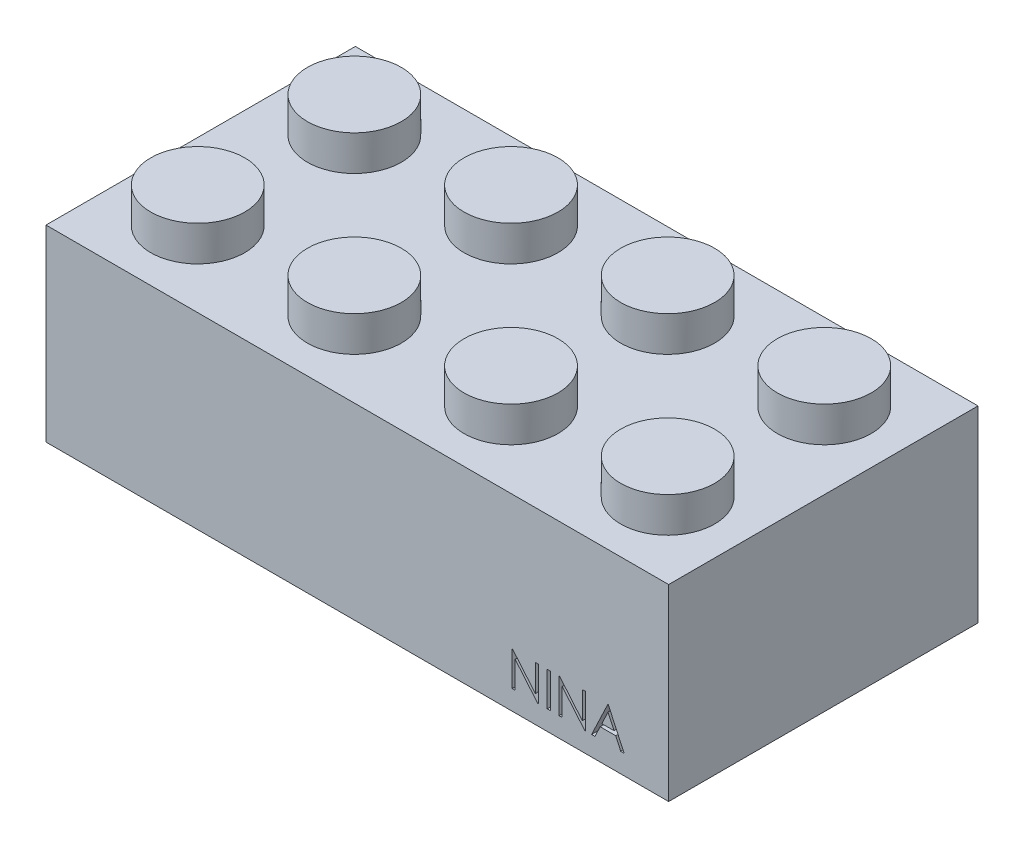
from build123d import *

# Parameters (mm, degrees)
SKETCH1_W               = 63.6
SKETCH1_H               = 31.6
BOSS_EXTRUDE1_DEPTH     = 19.2
SKETCH2_W               = 58.8
SKETCH2_H               = 26.8
CUT_EXTRUDE1_DEPTH      = 17.2
SKETCH3_R               = 4.8
BOSS_EXTRUDE2_DEPTH     = 3.6
LPATTERN1_COUNT         = 4
LPATTERN1_PITCH         = 16
LPATTERN1_COUNT_DIR2    = 2
LPATTERN1_PITCH_DIR2    = 16
SKETCH4_R               = 2.6
CUT_EXTRUDE2_DEPTH      = 3.4
LPATTERN2_COUNT         = 4
LPATTERN2_PITCH         = 16
LPATTERN2_COUNT_DIR2    = 2
LPATTERN2_PITCH_DIR2    = 16
SKETCH5_R               = 6.51
SKETCH5_R_2             = 4.8
BOSS_EXTRUDE3_DEPTH     = 17.2
LPATTERN3_COUNT         = 2
LPATTERN3_PITCH         = 16
LPATTERN4_COUNT         = 2
LPATTERN4_PITCH         = 16
BOSS_EXTRUDE4_DEPTH     = 12.6
BOSS_EXTRUDE5_REACH     = 44.199
SKETCH7_R               = 0.6
LPATTERN5_COUNT         = 4
LPATTERN5_PITCH         = 16
SKETCH8_R               = 0.6
BOSS_EXTRUDE6_DEPTH     = 17.2
MIRROR2_COPY_1_REACH    = 44.199
MIRROR2_COPY_1_SKETCH_R = 0.6
MIRROR2_COPY_2_REACH    = 44.199
MIRROR2_COPY_2_SKETCH_R = 0.6
MIRROR2_COPY_3_REACH    = 44.199
MIRROR2_COPY_3_SKETCH_R = 0.6
SKETCH9_W               = 0.314102564
SKETCH9_H               = 3.5
CUT_EXTRUDE3_DEPTH      = 2
SKETCH10_R              = 0.6
BOSS_EXTRUDE7_DEPTH     = 17.2


with BuildPart() as part:
    # Sketch1 → Boss-Extrude1 (new body)
    with BuildSketch(Plane(origin=(0, 0, 0), x_dir=(1, 0, 0), z_dir=(0, 1, 0))):
        Rectangle(SKETCH1_W, SKETCH1_H)
    extrude(amount=BOSS_EXTRUDE1_DEPTH)

    # Sketch2 → Cut-Extrude1 (cut)
    with BuildSketch(Plane.XZ):
        Rectangle(SKETCH2_W, SKETCH2_H)
    extrude(amount=-CUT_EXTRUDE1_DEPTH, mode=Mode.SUBTRACT)

    # Sketch3 → Boss-Extrude2 (add)
    with BuildSketch(Plane(origin=(0, 19.2, 0), x_dir=(1, 0, 0), z_dir=(0, 1, 0))):
        with Locations(Location((24, 7.9, 0), (0, 0, 90))):
            Circle(SKETCH3_R)
    boss_extrude2 = extrude(amount=BOSS_EXTRUDE2_DEPTH)

    # LPattern1: Boss-Extrude2 4 × 2
    with Locations(*[(-i * LPATTERN1_PITCH, 0, j * LPATTERN1_PITCH_DIR2) for i in range(LPATTERN1_COUNT) for j in range(LPATTERN1_COUNT_DIR2) if (i, j) != (0, 0)]):
        add(boss_extrude2)

    # Sketch4 → Cut-Extrude2 (cut)
    with BuildSketch(Plane(origin=(0, 17.2, 0), x_dir=(-1, 0, 0), z_dir=(0, -1, 0))):
        with Locations(Location((-24, -7.9, 0), (0, 0, 90))):
            Circle(SKETCH4_R)
    cut_extrude2 = extrude(amount=-CUT_EXTRUDE2_DEPTH, mode=Mode.SUBTRACT)

    # LPattern2: Cut-Extrude2 4 × 2
    with Locations(*[(-i * LPATTERN2_PITCH, 0, -j * LPATTERN2_PITCH_DIR2) for i in range(LPATTERN2_COUNT) for j in range(LPATTERN2_COUNT_DIR2) if (i, j) != (0, 0)]):
        add(cut_extrude2, mode=Mode.SUBTRACT)

    # Sketch5 → Boss-Extrude3 (add)
    with BuildSketch(Plane.XZ.offset(-17.2)):
        with Locations(Location((0, 0, 0), (0, 0, 270))):
            Circle(SKETCH5_R)
        with Locations(Location((0, 0, 0), (0, 0, 270))):
            Circle(SKETCH5_R_2, mode=Mode.SUBTRACT)
    boss_extrude3 = extrude(amount=BOSS_EXTRUDE3_DEPTH)

    # LPattern3: Boss-Extrude3 ×2
    with Locations(*[(i * LPATTERN3_PITCH, 0, 0) for i in range(1, LPATTERN3_COUNT)]):
        add(boss_extrude3)

    # LPattern4: Boss-Extrude3 ×2
    with Locations(*[(-i * LPATTERN4_PITCH, 0, 0) for i in range(1, LPATTERN4_COUNT)]):
        add(boss_extrude3)

    # Sketch6 → Boss-Extrude4 (add)
    with BuildSketch(Plane.XZ.offset(-17.2)):
        with BuildLine():
            Line((0.8, 13.4), (0, 13.4))
            Line((0, 13.4), (0, 6.51))
            ThreePointArc((0, 6.51), (0.400760105, 6.497652756), (0.8, 6.460657861))
            Line((0.8, 6.460657861), (0.8, 13.4))
        make_face()
        with BuildLine():
            Line((0, 6.51), (0, 13.4))
            Line((0, 13.4), (-0.8, 13.4))
            Line((-0.8, 13.4), (-0.8, 6.460657861))
            ThreePointArc((-0.8, 6.460657861), (-0.400760105, 6.497652756), (0, 6.51))
        make_face()
        with BuildLine():
            Line((0, -13.4), (0, -6.51))
            ThreePointArc((0, -6.51), (-0.400760105, -6.497652756), (-0.8, -6.460657861))
            Line((-0.8, -6.460657861), (-0.8, -13.4))
            Line((-0.8, -13.4), (0, -13.4))
        make_face()
        with BuildLine():
            ThreePointArc((0.8, -6.460657861), (0.400760105, -6.497652756), (0, -6.51))
            Line((0, -6.51), (0, -13.4))
            Line((0, -13.4), (0.8, -13.4))
            Line((0.8, -13.4), (0.8, -6.460657861))
        make_face()
    extrude(amount=BOSS_EXTRUDE4_DEPTH)

    # Sketch7 → Boss-Extrude5 (add, up to next)
    with BuildSketch(Plane.XZ, mode=Mode.PRIVATE) as boss_extrude5_sk1:
        with Locations((24, 13.4)):
            Circle(SKETCH7_R)
    boss_extrude5_tool1 = extrude(boss_extrude5_sk1.sketch, amount=-BOSS_EXTRUDE5_REACH, mode=Mode.PRIVATE) - part.part
    boss_extrude5 = boss_extrude5_tool1.solids().sort_by_distance((24, 0, 13.4))[0]
    add(boss_extrude5)

    # LPattern5: Boss-Extrude5 ×4
    with Locations(*[(-i * LPATTERN5_PITCH, 0, 0) for i in range(1, LPATTERN5_COUNT)]):
        add(boss_extrude5)

    # Sketch8 → Boss-Extrude6 (add)
    with BuildSketch(Plane(origin=(0, 0, 0), x_dir=(-1, 0, 0), z_dir=(0, -1, 0))):
        with Locations((-29.4, -7.9)):
            Circle(SKETCH8_R)
    boss_extrude6 = extrude(amount=-BOSS_EXTRUDE6_DEPTH)

    # Mirror2: Boss-Extrude5 across plane
    add(boss_extrude5.mirror(Plane.XY))

    # Mirror2 copy 1 sketch → Mirror2 copy 1 (add, up to next)
    with BuildSketch(Plane(origin=(-16, 0, 0), x_dir=(1, 0, 0), z_dir=(0, -1, 0)), mode=Mode.PRIVATE) as mirror2_copy_1_sk1:
        with Locations((24, -13.4)):
            Circle(MIRROR2_COPY_1_SKETCH_R)
    mirror2_copy_1_tool1 = extrude(mirror2_copy_1_sk1.sketch, amount=-MIRROR2_COPY_1_REACH, mode=Mode.PRIVATE) - part.part
    add(mirror2_copy_1_tool1.solids().sort_by_distance((8, 0, -13.4))[0])

    # Mirror2 copy 2 sketch → Mirror2 copy 2 (add, up to next)
    with BuildSketch(Plane(origin=(-32, 0, 0), x_dir=(1, 0, 0), z_dir=(0, -1, 0)), mode=Mode.PRIVATE) as mirror2_copy_2_sk1:
        with Locations((24, -13.4)):
            Circle(MIRROR2_COPY_2_SKETCH_R)
    mirror2_copy_2_tool1 = extrude(mirror2_copy_2_sk1.sketch, amount=-MIRROR2_COPY_2_REACH, mode=Mode.PRIVATE) - part.part
    add(mirror2_copy_2_tool1.solids().sort_by_distance((-8, 0, -13.4))[0])

    # Mirror2 copy 3 sketch → Mirror2 copy 3 (add, up to next)
    with BuildSketch(Plane(origin=(-48, 0, 0), x_dir=(1, 0, 0), z_dir=(0, -1, 0)), mode=Mode.PRIVATE) as mirror2_copy_3_sk1:
        with Locations((24, -13.4)):
            Circle(MIRROR2_COPY_3_SKETCH_R)
    mirror2_copy_3_tool1 = extrude(mirror2_copy_3_sk1.sketch, amount=-MIRROR2_COPY_3_REACH, mode=Mode.PRIVATE) - part.part
    add(mirror2_copy_3_tool1.solids().sort_by_distance((-24, 0, -13.4))[0])

    # Sketch9 → Cut-Extrude3 (cut)
    # profile 1 of 4: a face of its own
    with BuildSketch(Plane.XY.offset(15.8)):
        Polygon((15.808248921, 2), (15.808248921, 5.5), (15.87415437, 5.5), (18.186454049, 2.745292468), (18.186454049, 5.5), (18.500556613, 5.5), (18.500556613, 2), (18.42904219, 2), (16.122351485, 4.748397436), (16.122351485, 2), align=None)
    # profile 2 of 4: a face of its own
    with BuildSketch(Plane.XY.offset(15.8)):
        with Locations((19.555043793, 3.75)):
            Rectangle(SKETCH9_W, SKETCH9_H)
    # profile 3 of 4: a face of its own
    with BuildSketch(Plane.XY.offset(15.8)):
        Polygon((20.609530972, 2), (20.609530972, 5.5), (20.675436421, 5.5), (22.987736101, 2.745292468), (22.987736101, 5.5), (23.301838665, 5.5), (23.301838665, 2), (23.230324242, 2), (20.923633537, 4.748397436), (20.923633537, 2), align=None)
    # profile 4 of 4: a face of its own
    with BuildSketch(Plane.XY.offset(15.8)):
        Polygon((25.635171998, 5.5), (27.250556613, 2), (26.909110299, 2), (26.391682415, 3.121794872), (24.805043793, 3.121794872), (24.273593472, 2), (23.930043793, 2), (25.590300203, 5.5), align=None)
        Polygon((25.609230492, 4.817107372), (24.976117511, 3.480769231), (26.226217671, 3.480769231), align=None, mode=Mode.SUBTRACT)
    extrude(amount=-CUT_EXTRUDE3_DEPTH, mode=Mode.SUBTRACT)

    # Sketch10 → Boss-Extrude7 (add)
    with BuildSketch(Plane(origin=(0, 0, 0), x_dir=(-1, 0, 0), z_dir=(0, -1, 0))):
        with Locations((-29.4, 7.9)):
            Circle(SKETCH10_R)
    boss_extrude7 = extrude(amount=-BOSS_EXTRUDE7_DEPTH)

    # Mirror3: Boss-Extrude6, Boss-Extrude7 across plane
    add(boss_extrude6.mirror(Plane(origin=(0, 0, 0), x_dir=(0, 0, 1), z_dir=(1, 0, 0))))
    add(boss_extrude7.mirror(Plane(origin=(0, 0, 0), x_dir=(0, 0, 1), z_dir=(1, 0, 0))))


solid = part.part
